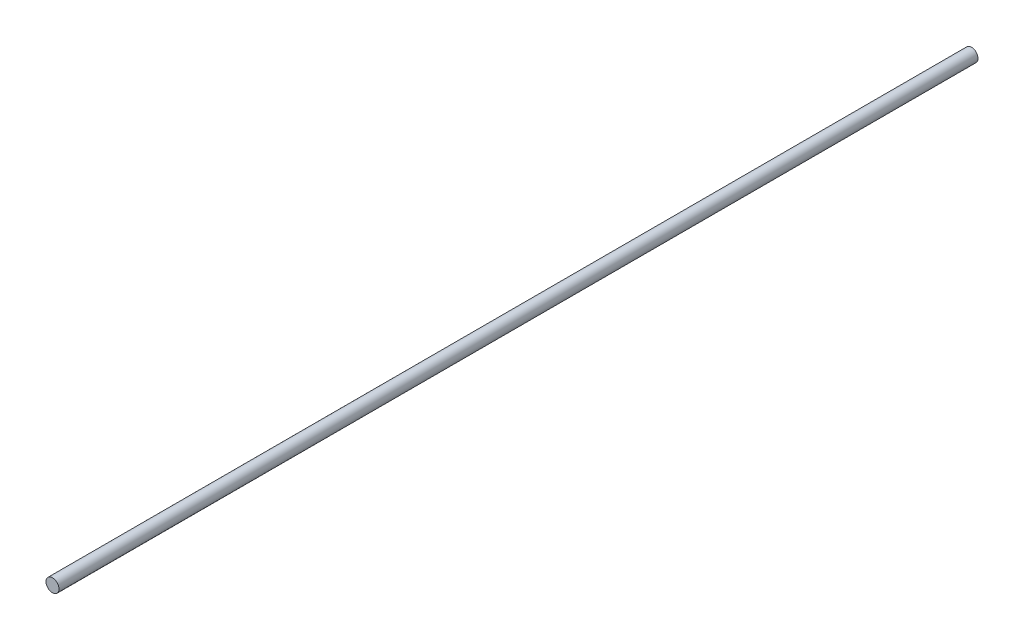
from build123d import *

# Parameters (mm, degrees)
SKIZZE1_R                       = 1.5
AUFSATZ_LINEAR_AUSTRAGEN1_DEPTH = 212


with BuildPart() as part:
    # Skizze1 → Aufsatz-Linear austragen1 (new body)
    with BuildSketch(Plane.XY):
        Circle(SKIZZE1_R)
    extrude(amount=AUFSATZ_LINEAR_AUSTRAGEN1_DEPTH)


solid = part.part
